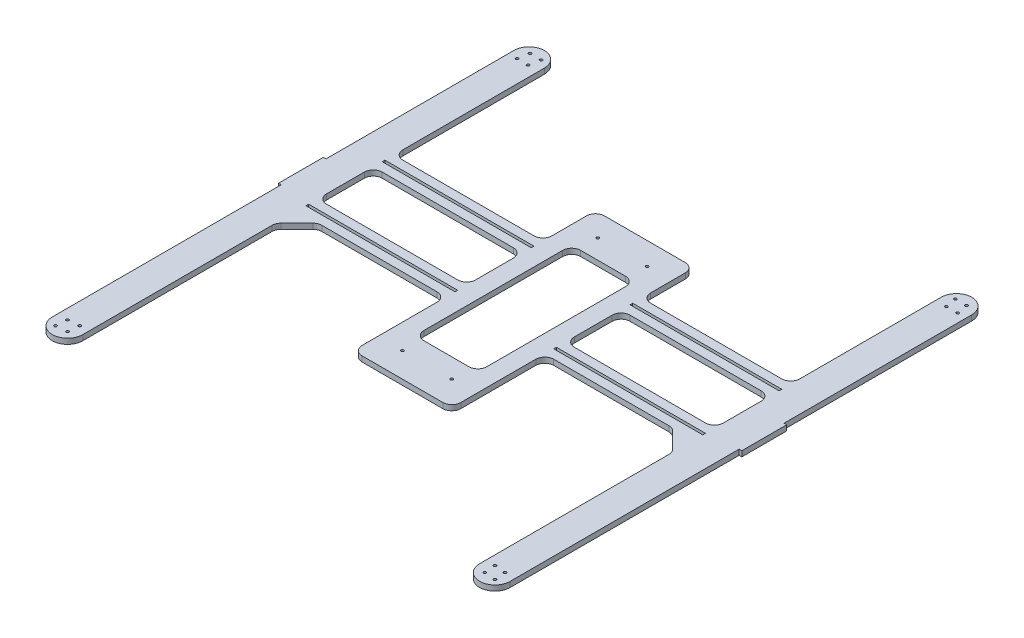
from build123d import *

# Parameters (mm, degrees)
SKETCH1_R           = 1.5
SKETCH1_W           = 166
SKETCH1_H           = 3
SKETCH1_H_2         = 62
SKETCH1_W_2         = 70
SKETCH1_H_3         = 174.5
BOSS_EXTRUDE1_DEPTH = 6
FILLET_1_R          = 10


with BuildPart() as part:
    # Sketch1 → Boss-Extrude1 (new body)
    with BuildSketch(Plane(origin=(0, 0, 0), x_dir=(1, 0, 0), z_dir=(0, 1, 0))):
        with BuildLine():
            Line((216, -40), (216, -255))
            ThreePointArc((216, -255), (233, -272), (250, -255))
            Line((250, -255), (250, 0))
            Line((250, 0), (253, 0))
            Line((253, 0), (253, 50))
            Line((253, 50), (250, 50))
            Line((250, 50), (250, 259.060301809))
            ThreePointArc((250, 259.060301809), (233, 276.060301809), (216, 259.060301809))
            Line((216, 259.060301809), (216, 91.5))
            Line((216, 91.5), (50, 91.5))
            Line((50, 91.5), (50, 150))
            Line((50, 150), (-60, 150))
            Line((-60, 150), (-60, 91.5))
            Line((-60, 91.5), (-226, 91.5))
            Line((-226, 91.5), (-226, 259.060301809))
            ThreePointArc((-226, 259.060301809), (-243, 276.060301809), (-260, 259.060301809))
            Line((-260, 259.060301809), (-260, 50))
            Line((-260, 50), (-263, 50))
            Line((-263, 50), (-263, 0))
            Line((-263, 0), (-260, 0))
            Line((-260, 0), (-260, -255))
            ThreePointArc((-260, -255), (-243, -272), (-226, -255))
            Line((-226, -255), (-226, -40))
            Line((-226, -40), (-202.5, -16.5))
            Line((-202.5, -16.5), (-60, -16.5))
            Line((-60, -16.5), (-60, -120))
            Line((-60, -120), (50, -120))
            Line((50, -120), (50, -16.5))
            Line((50, -16.5), (192.5, -16.5))
            Line((192.5, -16.5), (216, -40))
        make_face()
        with Locations(Location((238.092169369, 265.230375643, 0), (0, 0, 270))):
            Circle(SKETCH1_R, mode=Mode.SUBTRACT)
        with Locations(Location((225.673037322, 265.107252935, 0), (0, 0, 270))):
            Circle(SKETCH1_R, mode=Mode.SUBTRACT)
        with Locations(Location((227.907830631, 252.890227975, 0), (0, 0, 270))):
            Circle(SKETCH1_R, mode=Mode.SUBTRACT)
        with Locations(Location((240.326962678, 253.013350683, 0), (0, 0, 270))):
            Circle(SKETCH1_R, mode=Mode.SUBTRACT)
        with Locations(Location((226.282485579, -248.282485579, 0), (0, 0, 270))):
            Circle(SKETCH1_R, mode=Mode.SUBTRACT)
        with Locations(Location((238.656854249, -249.343145751, 0), (0, 0, 270))):
            Circle(SKETCH1_R, mode=Mode.SUBTRACT)
        with Locations(Location((239.717514421, -261.717514421, 0), (0, 0, 270))):
            Circle(SKETCH1_R, mode=Mode.SUBTRACT)
        with Locations(Location((227.343145751, -260.656854249, 0), (0, 0, 270))):
            Circle(SKETCH1_R, mode=Mode.SUBTRACT)
        with Locations(Location((22.5, 125, 0), (0, 0, 270))):
            Circle(SKETCH1_R, mode=Mode.SUBTRACT)
        with Locations(Location((-32.5, 125, 0), (0, 0, 270))):
            Circle(SKETCH1_R, mode=Mode.SUBTRACT)
        with Locations(Location((-237.343145751, -260.656854249, 0), (0, 0, 270))):
            Circle(SKETCH1_R, mode=Mode.SUBTRACT)
        with Locations(Location((-249.717514421, -261.717514421, 0), (0, 0, 270))):
            Circle(SKETCH1_R, mode=Mode.SUBTRACT)
        with Locations(Location((-248.656854249, -249.343145751, 0), (0, 0, 270))):
            Circle(SKETCH1_R, mode=Mode.SUBTRACT)
        with Locations(Location((-236.282485579, -248.282485579, 0), (0, 0, 270))):
            Circle(SKETCH1_R, mode=Mode.SUBTRACT)
        with Locations(Location((-250.326962678, 253.013350683, 0), (0, 0, 270))):
            Circle(SKETCH1_R, mode=Mode.SUBTRACT)
        with Locations(Location((-237.907830631, 252.890227975, 0), (0, 0, 270))):
            Circle(SKETCH1_R, mode=Mode.SUBTRACT)
        with Locations(Location((-235.673037322, 265.107252935, 0), (0, 0, 270))):
            Circle(SKETCH1_R, mode=Mode.SUBTRACT)
        with Locations(Location((-248.092169369, 265.230375643, 0), (0, 0, 270))):
            Circle(SKETCH1_R, mode=Mode.SUBTRACT)
        with Locations(Location((22.5, -92.5, 0), (0, 0, 270))):
            Circle(SKETCH1_R, mode=Mode.SUBTRACT)
        with Locations(Location((-32.5, -92.5, 0), (0, 0, 270))):
            Circle(SKETCH1_R, mode=Mode.SUBTRACT)
        with Locations((133, 80)):
            Rectangle(SKETCH1_W, SKETCH1_H, mode=Mode.SUBTRACT)
        with Locations((133, 37.5)):
            Rectangle(SKETCH1_W, SKETCH1_H_2, mode=Mode.SUBTRACT)
        with Locations((-143, 37.5)):
            Rectangle(SKETCH1_W, SKETCH1_H_2, mode=Mode.SUBTRACT)
        with Locations((133, -5)):
            Rectangle(SKETCH1_W, SKETCH1_H, mode=Mode.SUBTRACT)
        with Locations((-143, -5)):
            Rectangle(SKETCH1_W, SKETCH1_H, mode=Mode.SUBTRACT)
        with Locations((-143, 80)):
            Rectangle(SKETCH1_W, SKETCH1_H, mode=Mode.SUBTRACT)
        with Locations((-5, 16.25)):
            Rectangle(SKETCH1_W_2, SKETCH1_H_3, mode=Mode.SUBTRACT)
    extrude(amount=BOSS_EXTRUDE1_DEPTH)

    # Скругление1
    fillet_1_edges = [part.edges().sort_by_distance(p)[0] for p in [
        (30, 3, 71),
        (30, 3, -103.5),
        (-40, 3, -103.5),
        (-40, 3, 71),
        (216, 3, -6.5),
        (216, 3, -68.5),
        (50, 3, -68.5),
        (50, 3, -6.5),
        (-226, 3, -68.5),
        (-226, 3, -6.5),
        (-60, 3, -6.5),
        (-60, 3, -68.5),
        (-226, 3, -91.5),
        (-60, 3, -91.5),
        (-60, 3, -150),
        (50, 3, -150),
        (50, 3, -91.5),
        (216, 3, -91.5),
        (216, 3, 40),
        (192.5, 3, 16.5),
        (50, 3, 16.5),
        (50, 3, 120),
        (-60, 3, 120),
        (-60, 3, 16.5),
        (-202.5, 3, 16.5),
        (-226, 3, 40),
    ]]
    fillet(fillet_1_edges, radius=FILLET_1_R)


solid = part.part
